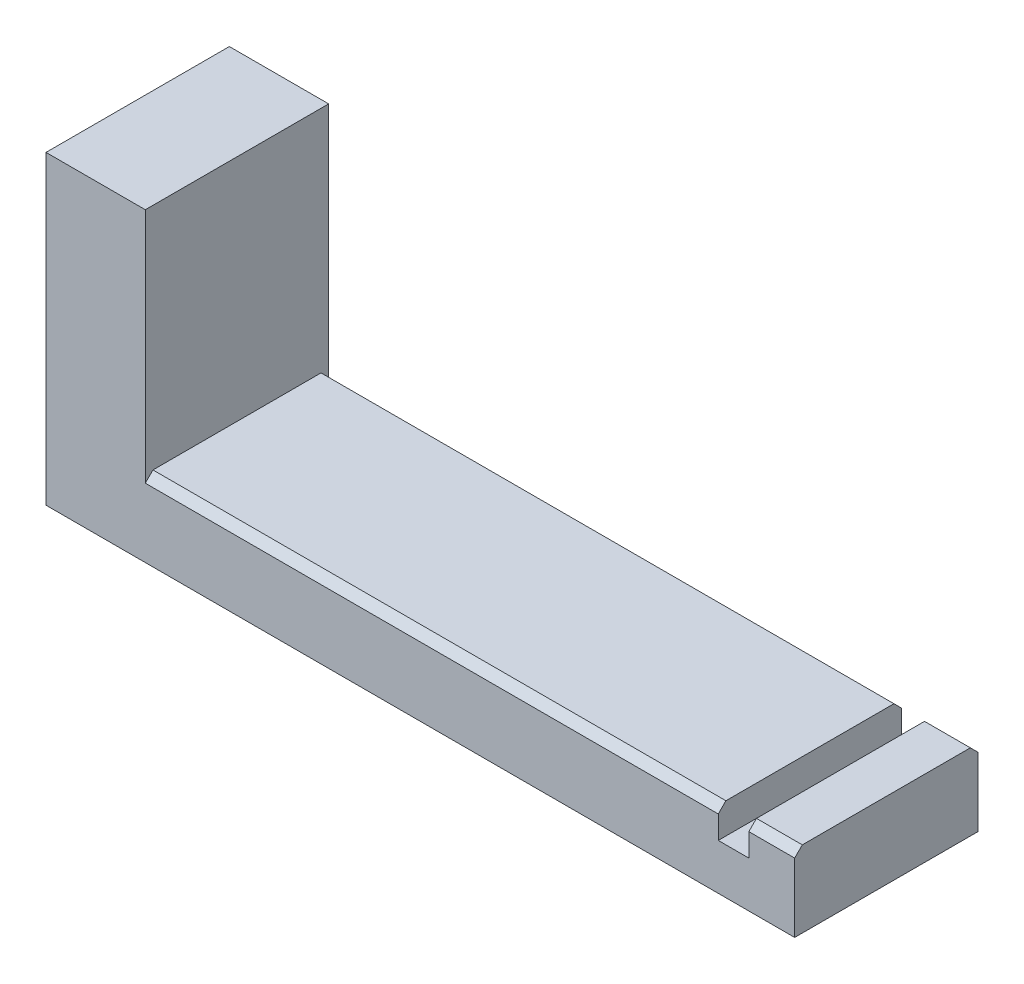
from build123d import *

# Parameters (mm, degrees)
BOSS_EXTRUDE1_DEPTH = 12
CHAMFER1_SIZE       = 1


with BuildPart() as part:
    # Sketch1 → Boss-Extrude1 (new, symmetric)
    with BuildSketch(Plane.XY):
        Polygon((0, 0), (0, 40), (13, 40), (13, 10), (88, 10), (88, 6), (92, 6), (92, 10), (98, 10), (98, 0), align=None)
    extrude(amount=BOSS_EXTRUDE1_DEPTH, both=True)

    # Chamfer1
    chamfer1_edges = [part.edges().sort_by_distance(p)[0] for p in [
        (50.5, 10, -12),
        (95, 10, 12),
        (95, 10, -12),
        (50.5, 10, 12),
    ]]
    chamfer(chamfer1_edges, length=CHAMFER1_SIZE)


solid = part.part
